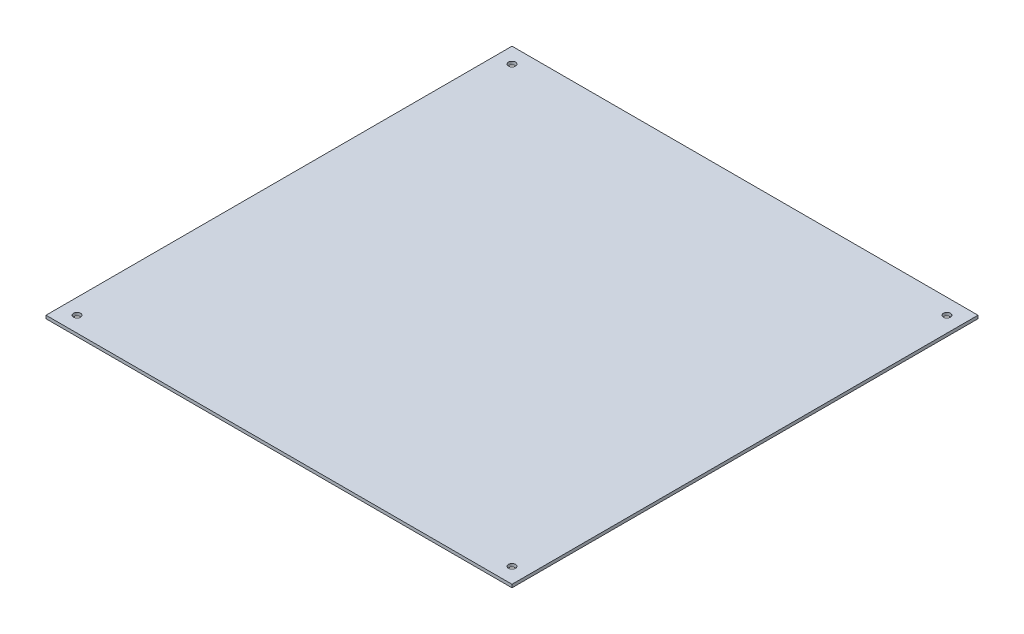
from build123d import *

# Parameters (mm, degrees)
SKETCH1_W           = 600
SKETCH1_H           = 600
BOSS_EXTRUDE1_DEPTH = 4
CUT_EXTRUDE1_REACH  = 850.538
SKETCH2_R           = 4.5


with BuildPart() as part:
    # Sketch1 → Boss-Extrude1 (new body)
    with BuildSketch(Plane(origin=(0, 0, 0), x_dir=(1, 0, 0), z_dir=(0, 1, 0))):
        with Locations((300, 300)):
            Rectangle(SKETCH1_W, SKETCH1_H)
    extrude(amount=BOSS_EXTRUDE1_DEPTH)

    # Sketch2 → Cut-Extrude1 (cut, up to next)
    with BuildSketch(Plane(origin=(0, 4, 0), x_dir=(1, 0, 0), z_dir=(0, 1, 0)), mode=Mode.PRIVATE) as cut_extrude1_sk1:
        with Locations(Location((20, 580, 0), (0, 0, 270))):
            Circle(SKETCH2_R)
    cut_extrude1_tool1 = extrude(cut_extrude1_sk1.sketch, amount=-CUT_EXTRUDE1_REACH, mode=Mode.PRIVATE) & part.part
    # Sketch2 → Cut-Extrude1 (cut, up to next)
    with BuildSketch(Plane(origin=(0, 4, 0), x_dir=(1, 0, 0), z_dir=(0, 1, 0)), mode=Mode.PRIVATE) as cut_extrude1_sk2:
        with Locations(Location((580, 580, 0), (0, 0, 270))):
            Circle(SKETCH2_R)
    cut_extrude1_tool2 = extrude(cut_extrude1_sk2.sketch, amount=-CUT_EXTRUDE1_REACH, mode=Mode.PRIVATE) & part.part
    # Sketch2 → Cut-Extrude1 (cut, up to next)
    with BuildSketch(Plane(origin=(0, 4, 0), x_dir=(1, 0, 0), z_dir=(0, 1, 0)), mode=Mode.PRIVATE) as cut_extrude1_sk3:
        with Locations(Location((580, 20, 0), (0, 0, 270))):
            Circle(SKETCH2_R)
    cut_extrude1_tool3 = extrude(cut_extrude1_sk3.sketch, amount=-CUT_EXTRUDE1_REACH, mode=Mode.PRIVATE) & part.part
    # Sketch2 → Cut-Extrude1 (cut, up to next)
    with BuildSketch(Plane(origin=(0, 4, 0), x_dir=(1, 0, 0), z_dir=(0, 1, 0)), mode=Mode.PRIVATE) as cut_extrude1_sk4:
        with Locations(Location((20, 20, 0), (0, 0, 270))):
            Circle(SKETCH2_R)
    cut_extrude1_tool4 = extrude(cut_extrude1_sk4.sketch, amount=-CUT_EXTRUDE1_REACH, mode=Mode.PRIVATE) & part.part
    add(cut_extrude1_tool1.solids().sort_by_distance((20, 4, -580))[0], mode=Mode.SUBTRACT)
    add(cut_extrude1_tool2.solids().sort_by_distance((580, 4, -580))[0], mode=Mode.SUBTRACT)
    add(cut_extrude1_tool3.solids().sort_by_distance((580, 4, -20))[0], mode=Mode.SUBTRACT)
    add(cut_extrude1_tool4.solids().sort_by_distance((20, 4, -20))[0], mode=Mode.SUBTRACT)


solid = part.part
